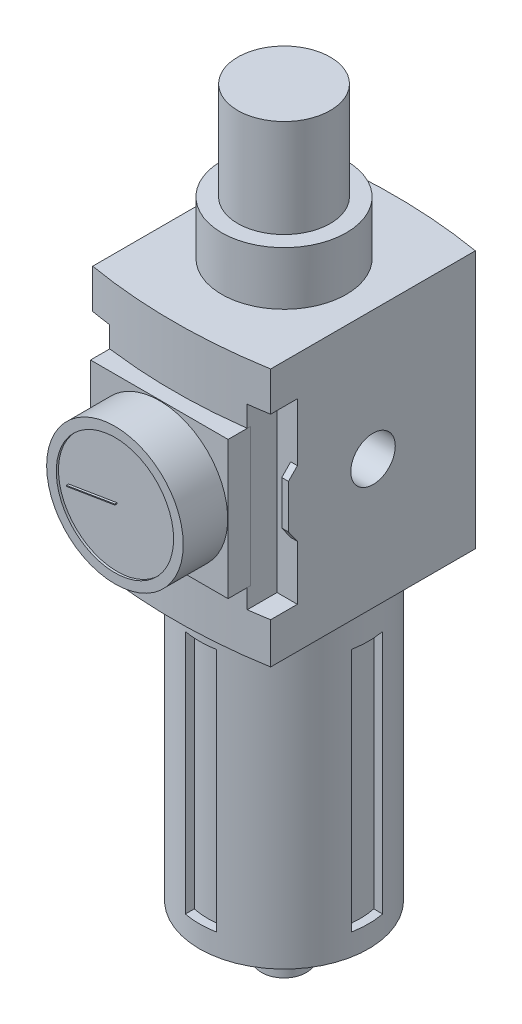
from build123d import *

# Parameters (mm, degrees)
SKETCH_1_R           = 19
EXTRUDE_1_DEPTH      = 69
CHAMFER_1_SIZE       = 10
CHAMFER_1_SIZE2      = 2.125565617
EXTRUDE_2_DEPTH      = 3.5
SKETCH_3_R           = 5
SKETCH_3_R_2         = 0.834244999
EXTRUDE_3_DEPTH      = 6
EXTRUDE_4_DEPTH      = 58
SKETCH_5_W           = 31
SKETCH_5_H           = 31
EXTRUDE_5_DEPTH      = 5
SKETCH_6_R           = 15.35
EXTRUDE_6_DEPTH      = 10
SKETCH_7_R           = 13.183834188
CUT_EXTRUDE_7_DEPTH  = 0.5
SKETCH_9_R           = 14
EXTRUDE_8_DEPTH      = 12
SKETCH_10_R          = 10.4
EXTRUDE_9_DEPTH      = 22
CUT_EXTRUDE_START    = 55
CUT_EXTRUDE_11_DEPTH = 55
SKETCH_12_W          = 4.576157751
SKETCH_12_H          = 40
SKETCH_12_W_2        = 4.510929988
CUT_EXTRUDE_12_DEPTH = 6
EXTRUDE_13_DEPTH     = 1.5
SKETCH_15_R          = 5.5
CUT_EXTRUDE_14_DEPTH = 6
SKETCH_16_R          = 5
CUT_EXTRUDE_15_DEPTH = 15


with BuildPart() as part:
    # 草图1 → 拉伸1 (new body)
    with BuildSketch(Plane(origin=(0, 0, 0), x_dir=(1, 0, 0), z_dir=(0, 1, 0))):
        with Locations(Location((0, 0, 0), (0, 0, 270))):
            Circle(SKETCH_1_R)
    extrude(amount=EXTRUDE_1_DEPTH)

    # 倒角1
    chamfer_1_edges = [part.edges().sort_by_distance(p)[0] for p in [
        (0, 0, -19),
    ]]
    chamfer_1_side = [part.faces().sort_by_distance(p)[0] for p in [
        (0, 0, 0),
    ]]
    chamfer(chamfer_1_edges, length=CHAMFER_1_SIZE, length2=CHAMFER_1_SIZE2, reference=chamfer_1_side[0])

    # 草图11 → 拉伸11 (cut)
    with BuildSketch(Plane.XZ.offset(-62).offset(CUT_EXTRUDE_START)):
        with BuildLine():
            Line((16.671271122, 3.5), (18.674849397, 3.5))
            ThreePointArc((18.674849397, 3.5), (19, 0), (18.674849397, -3.5))
            Line((18.674849397, -3.5), (16.671271122, -3.5))
            ThreePointArc((16.671271122, -3.5), (17.034708123, 0), (16.671271122, 3.5))
        make_face()
        with BuildLine():
            Line((-3.5, 16.671271122), (-3.5, 18.674849397))
            ThreePointArc((-3.5, 18.674849397), (0, 19), (3.5, 18.674849397))
            Line((3.5, 18.674849397), (3.5, 16.671271122))
            ThreePointArc((3.5, 16.671271122), (0, 17.034708123), (-3.5, 16.671271122))
        make_face()
        with BuildLine():
            Line((3.5, -16.671271122), (3.5, -18.674849397))
            ThreePointArc((3.5, -18.674849397), (0, -19), (-3.5, -18.674849397))
            Line((-3.5, -18.674849397), (-3.5, -16.671271122))
            ThreePointArc((-3.5, -16.671271122), (0, -17.034708123), (3.5, -16.671271122))
        make_face()
        with BuildLine():
            Line((-16.671271122, -3.5), (-18.674849397, -3.5))
            ThreePointArc((-18.674849397, -3.5), (-19, 0), (-18.674849397, 3.5))
            Line((-18.674849397, 3.5), (-16.671271122, 3.5))
            ThreePointArc((-16.671271122, 3.5), (-17.034708123, 0), (-16.671271122, -3.5))
        make_face()
    extrude(amount=-CUT_EXTRUDE_11_DEPTH, mode=Mode.SUBTRACT)


with BuildPart() as body_2:
    # 草图2 → 拉伸2 (new body)
    with BuildSketch(Plane.XZ):
        Polygon((5.902320346, -3.628031772), (6.093127853, 3.297543474), (0.190807508, 6.925575247), (-5.902320346, 3.628031772), (-6.093127853, -3.297543474), (-0.190807508, -6.925575247), align=None)
    extrude(amount=EXTRUDE_2_DEPTH)


with BuildPart() as body_3:
    # 草图3 → 拉伸3 (new body)
    with BuildSketch(Plane.XZ.offset(3.5)):
        with Locations(Location((0, 0, 0), (0, 0, 270))):
            Circle(SKETCH_3_R)
        with Locations(Location((0, 0, 0), (0, 0, 270))):
            Circle(SKETCH_3_R_2, mode=Mode.SUBTRACT)
    extrude(amount=EXTRUDE_3_DEPTH)


with BuildPart() as body_4:
    # 草图4 → 拉伸4 (new body)
    with BuildSketch(Plane(origin=(0, 69, 0), x_dir=(1, 0, 0), z_dir=(0, 1, 0))):
        with BuildLine():
            Line((-20, -23), (-20, 23))
            ThreePointArc((-20, 23), (0, 24.673983482), (20, 23))
            Line((20, 23), (20, -23))
            ThreePointArc((20, -23), (0, -24.706329443), (-20, -23))
        make_face()
    extrude(amount=EXTRUDE_4_DEPTH)

    # 草图9 → 拉伸8 (add)
    with BuildSketch(Plane(origin=(0, 127, 0), x_dir=(1, 0, 0), z_dir=(0, 1, 0))):
        with Locations(Location((0, 0, 0), (0, 0, 90))):
            Circle(SKETCH_9_R)
    extrude(amount=EXTRUDE_8_DEPTH)

    # 草图10 → 拉伸9 (add)
    with BuildSketch(Plane(origin=(0, 139, 0), x_dir=(1, 0, 0), z_dir=(0, 1, 0))):
        with Locations(Location((0, 0, 0), (0, 0, 270))):
            Circle(SKETCH_10_R)
    extrude(amount=EXTRUDE_9_DEPTH)


with BuildPart() as body_5:
    # 草图5 → 拉伸5 (new body)
    with BuildSketch(Plane.XY.offset(23)):
        with Locations((0, 98)):
            Rectangle(SKETCH_5_W, SKETCH_5_H)
    extrude(amount=EXTRUDE_5_DEPTH)

    # 草图6 → 拉伸6 (add)
    with BuildSketch(Plane.XY.offset(28)):
        with Locations(Location((0, 98, 0), (0, 0, 180))):
            Circle(SKETCH_6_R)
    extrude(amount=EXTRUDE_6_DEPTH)

    # 草图7 → 拉伸7 (cut)
    with BuildSketch(Plane.XY.offset(38)):
        with Locations((0, 98)):
            Circle(SKETCH_7_R)
        Polygon((0, 98), (-10.888731231, 96.200291232), (-10.921345112, 96.397614152), (-0.032613881, 98.19732292), align=None, mode=Mode.SUBTRACT)
    extrude(amount=-CUT_EXTRUDE_7_DEPTH, mode=Mode.SUBTRACT)


with BuildPart() as cut_extrude_12_tool:
    # 草图12 → 拉伸12 (new, symmetric)
    with BuildSketch(Plane.XY.offset(23)):
        with Locations((17.711921125, 98.19732292)):
            Rectangle(SKETCH_12_W, SKETCH_12_H)
        with Locations((-17.744535006, 98.19732292)):
            Rectangle(SKETCH_12_W_2, SKETCH_12_H)
    extrude(amount=CUT_EXTRUDE_12_DEPTH, both=True)


with BuildPart() as body_4_1:
    add(body_4.part)

    # 拉伸12: cut by cut_extrude_12_tool
    add(cut_extrude_12_tool.part, mode=Mode.SUBTRACT)

    # 草图14 → 拉伸13 (add)
    with BuildSketch(Plane.ZY.offset(20)):
        Polygon((17, 105.180615559), (17, 90.453235832), (19, 93.276872504), (19, 103.117773336), align=None)
    extrude_13 = extrude(amount=-EXTRUDE_13_DEPTH)

    # 镜向1: 拉伸13 across plane
    add(extrude_13.mirror(Plane(origin=(0, 0, 0), x_dir=(0, 0, 1), z_dir=(1, 0, 0))))

    # 草图15 → 拉伸14 (cut)
    with BuildSketch(Plane.ZY.offset(20)):
        with Locations((0, 98.108057789)):
            Circle(SKETCH_15_R)
    extrude(amount=-CUT_EXTRUDE_14_DEPTH, mode=Mode.SUBTRACT)

    # 草图16 → 拉伸15 (cut)
    with BuildSketch(Plane(origin=(20, 0, 0), x_dir=(0, 0, -1), z_dir=(1, 0, 0))):
        with Locations((0, 98)):
            Circle(SKETCH_16_R)
    extrude(amount=-CUT_EXTRUDE_15_DEPTH, mode=Mode.SUBTRACT)


with BuildPart() as body_5_1:
    add(body_5.part)

    # 拉伸12: cut by cut_extrude_12_tool
    add(cut_extrude_12_tool.part, mode=Mode.SUBTRACT)


solid = Compound([part.part, body_2.part, body_3.part, body_4_1.part, body_5_1.part])
